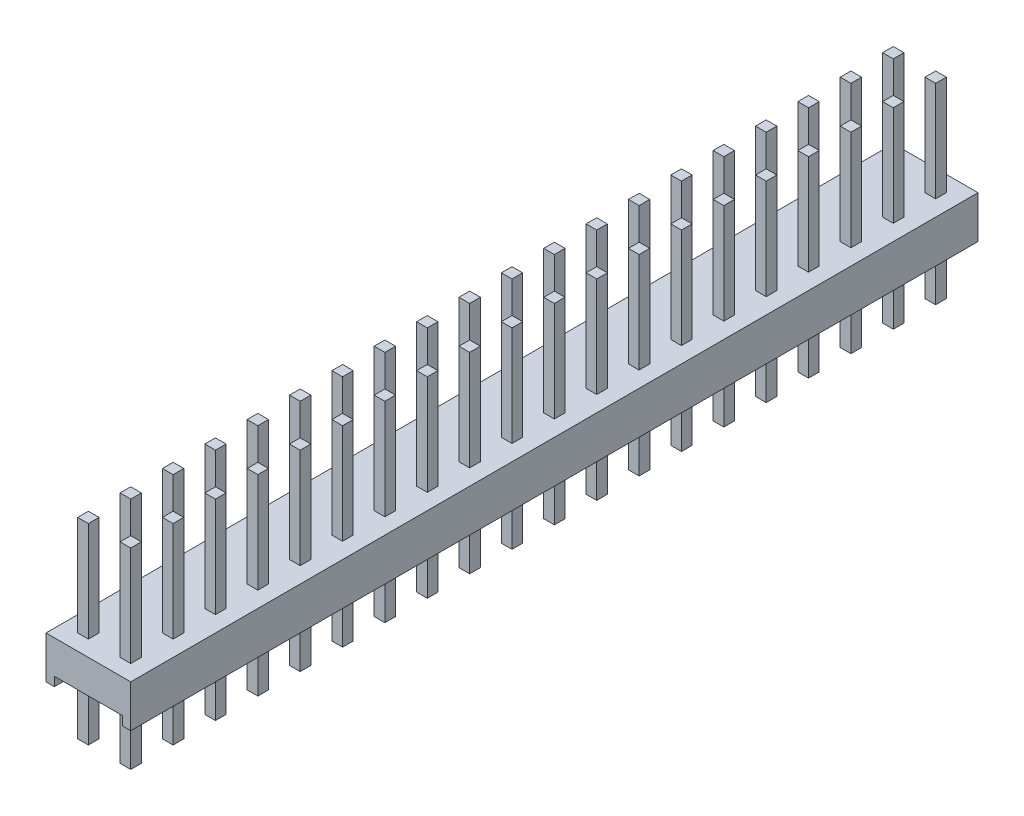
from build123d import *

# Parameters (mm, degrees)
EXTRUDE_1_DEPTH         = 2.54
EXTRUDE_START           = -5.5
SKETCH_2_W              = 0.64
SKETCH_2_H              = 0.64
EXTRUDE_2_DEPTH         = 11.5
PATTERN_LINEAR_27_COUNT = 20
PATTERN_LINEAR_27_PITCH = 2.54


with BuildPart() as part:
    # Эскиз1 → Бобышка-Вытянуть1 (new body)
    with BuildSketch(Plane.XY):
        Polygon((-2.54, 0), (-2.54, 2.54), (2.54, 2.54), (2.54, 0), (2.04, 0), (2.04, 0.54), (-2.04, 0.54), (-2.04, 0), align=None)
    extrude_1 = extrude(amount=EXTRUDE_1_DEPTH)

    # Эскиз2 → Бобышка-Вытянуть2 (add)
    with BuildSketch(Plane(origin=(0, 2.54, 0), x_dir=(1, 0, 0), z_dir=(0, 1, 0)).offset(EXTRUDE_START)):
        with Locations((-1.27, -1.27)):
            Rectangle(SKETCH_2_W, SKETCH_2_H)
        with Locations((1.27, -1.27)):
            Rectangle(SKETCH_2_W, SKETCH_2_H)
    extrude_2 = extrude(amount=EXTRUDE_2_DEPTH)

    # Линейный массив27: Бобышка-Вытянуть1, Бобышка-Вытянуть2 ×20
    with Locations(*[(0, 0, -i * PATTERN_LINEAR_27_PITCH) for i in range(1, PATTERN_LINEAR_27_COUNT)]):
        add(extrude_1)
        add(extrude_2)


solid = part.part
